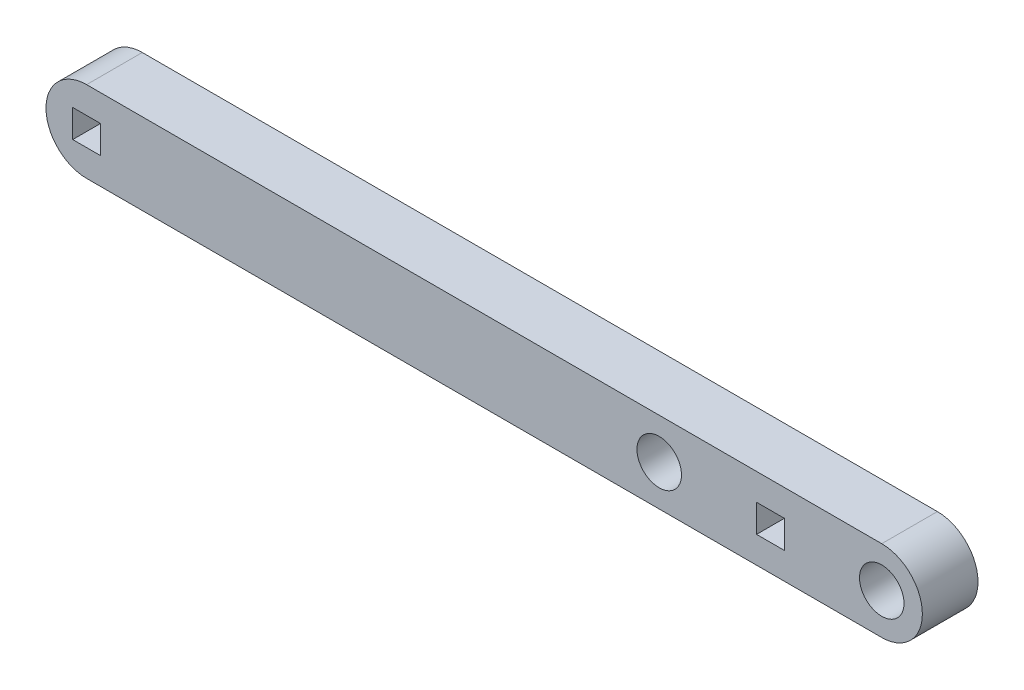
from build123d import *

# Parameters (mm, degrees)
SKETCH1_R           = 2.54
SKETCH1_W           = 3.175
SKETCH1_H           = 3.175
BOSS_EXTRUDE1_DEPTH = 6.35


with BuildPart() as part:
    # Sketch1 → Boss-Extrude1 (new body)
    with BuildSketch(Plane.XY):
        with BuildLine():
            Line((0, 4.636775303), (90.7542, 4.636775303))
            ThreePointArc((90.7542, 4.636775303), (95.390975303, 0), (90.7542, -4.636775303))
            Line((90.7542, -4.636775303), (0, -4.636775303))
            ThreePointArc((0, -4.636775303), (-4.636775303, 0), (0, 4.636775303))
        make_face()
        with Locations((90.7542, 0)):
            Circle(SKETCH1_R, mode=Mode.SUBTRACT)
        with Locations((65.3542, 0)):
            Circle(SKETCH1_R, mode=Mode.SUBTRACT)
        with Locations((78.0542, 0)):
            Rectangle(SKETCH1_W, SKETCH1_H, mode=Mode.SUBTRACT)
        Rectangle(SKETCH1_W, SKETCH1_H, mode=Mode.SUBTRACT)
    extrude(amount=BOSS_EXTRUDE1_DEPTH)


solid = part.part
